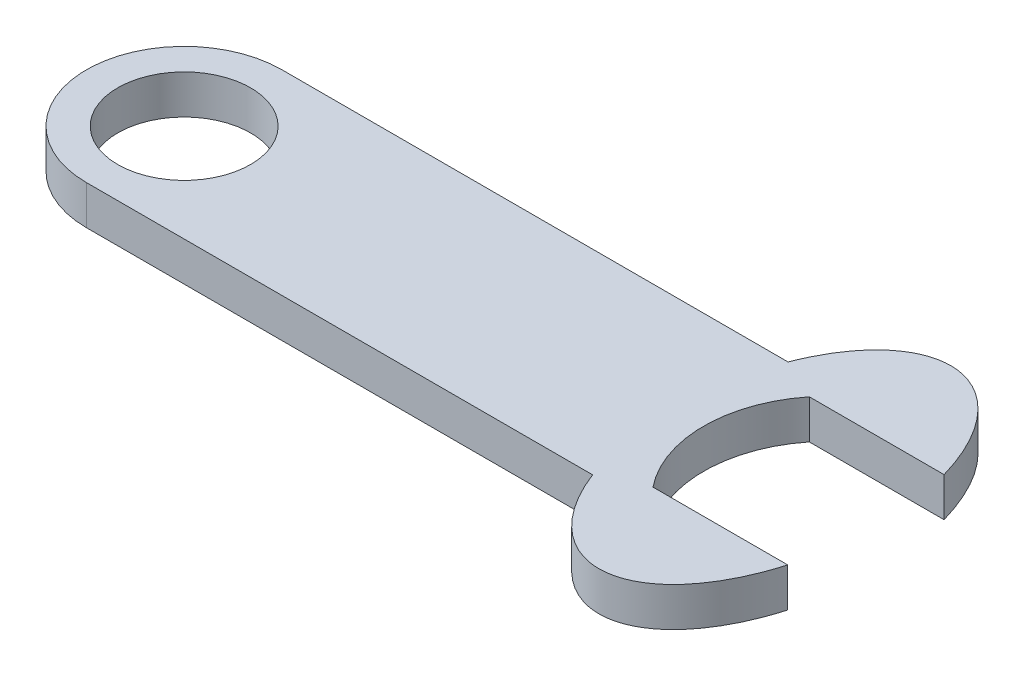
from build123d import *

# Parameters (mm, degrees)
SKETCH1_R           = 17
BOSS_EXTRUDE1_DEPTH = 10


with BuildPart() as part:
    # Sketch1 → Boss-Extrude1 (new body)
    with BuildSketch(Plane(origin=(0, 0, 0), x_dir=(1, 0, 0), z_dir=(0, 1, 0))):
        with BuildLine():
            Line((139.920082606, 20), (174.390966828, 20))
            add(Edge.make_bspline(
                [(174.390966828, 20), (154.431219393, 89.629118064), (129.481535099, 25)],
                knots=[2.031350318, 2.031350318, 2.031350318, 4.12335801, 4.12335801, 4.12335801], degree=2, weights=[1, 0.501033423, 1]))
            Line((129.481535099, 25), (0, 25))
            ThreePointArc((0, 25), (-25, 0), (0, -25))
            Line((0, -25), (129.481535099, -25))
            add(Edge.make_bspline(
                [(129.481535099, -25), (154.431219393, -89.629118064), (174.390966828, -20)],
                knots=[5.301419951, 5.301419951, 5.301419951, 7.393427642, 7.393427642, 7.393427642], degree=2, weights=[1, 0.501033423, 1]))
            Line((174.390966828, -20), (139.920082606, -20))
            ThreePointArc((139.920082606, -20), (132.900058234, 0), (139.920082606, 20))
        make_face()
        with Locations(Location((0, 0, 0), (0, 0, 270))):
            Circle(SKETCH1_R, mode=Mode.SUBTRACT)
    extrude(amount=BOSS_EXTRUDE1_DEPTH)


solid = part.part
